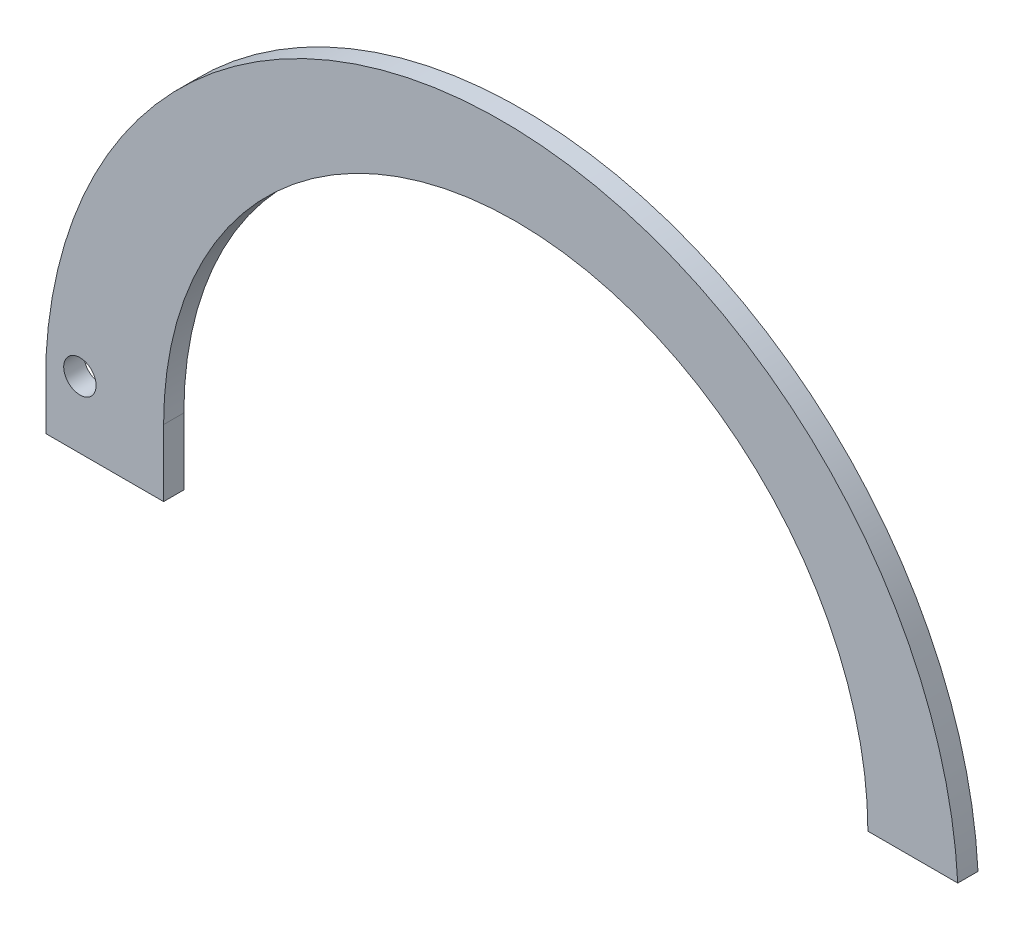
from build123d import *

# Parameters (mm, degrees)
SKETCH1_R           = 4
BOSS_EXTRUDE1_DEPTH = 5


with BuildPart() as part:
    # Sketch1 → Boss-Extrude1 (new body)
    with BuildSketch(Plane.XY):
        with BuildLine():
            Line((-8.372740898, -16.475626145), (20.666563893, -16.475626145))
            Line((20.666563893, -16.475626145), (20.666563893, 0))
            ThreePointArc((20.666563893, 0), (107.621336104, 86.954772211), (194.576108316, 0))
            Line((194.576108316, 0), (216.763442313, 0))
            ThreePointArc((216.763442313, 0), (104.195350708, 106.73896664), (-8.372740898, 0))
            Line((-8.372740898, 0), (-8.372740898, -16.475626145))
        make_face()
        Circle(SKETCH1_R, mode=Mode.SUBTRACT)
    extrude(amount=BOSS_EXTRUDE1_DEPTH)


solid = part.part
